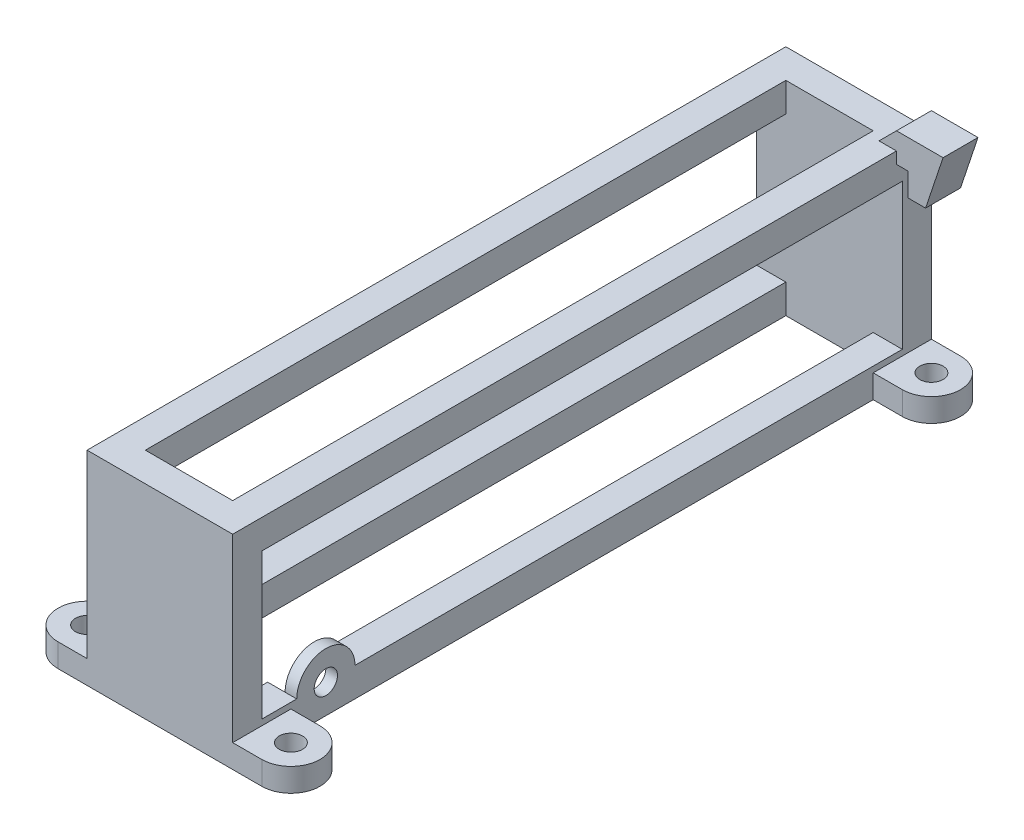
from build123d import *

# Parameters (mm, degrees)
SKETCH1_W           = 120
SKETCH1_H           = 35
SKETCH1_W_2         = 110
SKETCH1_H_2         = 25
BOSS_EXTRUDE1_DEPTH = 25
CUT_EXTRUDE1_REACH  = 129.475
SKETCH2_W           = 15
SKETCH2_H           = 110
SKETCH3_R           = 2
BOSS_EXTRUDE2_DEPTH = 4
SKETCH4_W           = 10
SKETCH4_H           = 5
CUT_EXTRUDE2_DEPTH  = 3
BOSS_EXTRUDE3_DEPTH = 2
SKETCH6_R           = 2
CUT_EXTRUDE3_DEPTH  = 2
BOSS_EXTRUDE4_DEPTH = 6


with BuildPart() as part:
    # Sketch1 → Boss-Extrude1 (new body)
    with BuildSketch(Plane(origin=(0, 0, 0), x_dir=(0, 0, -1), z_dir=(1, 0, 0))):
        with Locations((60, -17.5)):
            Rectangle(SKETCH1_W, SKETCH1_H)
        with Locations((60, -17.5)):
            Rectangle(SKETCH1_W_2, SKETCH1_H_2, mode=Mode.SUBTRACT)
    extrude(amount=BOSS_EXTRUDE1_DEPTH)

    # Cut-Extrude1: up to this face of the body (flat: up to its plane)
    cut_extrude1_end = Plane(part.part.faces().sort_by_distance((12.5, 0, -60))[0])
    # Sketch2 → Cut-Extrude1 (cut, up to the picked face)
    with BuildSketch(Plane(origin=(0, -35, 0), x_dir=(-1, 0, 0), z_dir=(0, -1, 0)), mode=Mode.PRIVATE) as cut_extrude1_sk1:
        with Locations((-12.5, 60)):
            Rectangle(SKETCH2_W, SKETCH2_H)
    cut_extrude1_tool1 = split(extrude(cut_extrude1_sk1.sketch, amount=-CUT_EXTRUDE1_REACH, mode=Mode.PRIVATE), bisect_by=cut_extrude1_end, keep=Keep.BOTH, mode=Mode.PRIVATE)
    add(cut_extrude1_tool1.solids().sort_by(Axis((12.5, -35, -60), (0, 1, 0)))[0], mode=Mode.SUBTRACT)

    # Sketch3 → Boss-Extrude2 (add)
    # profile 1 of 4: a face of its own
    with BuildSketch(Plane.XZ.offset(35)):
        with BuildLine():
            Line((0, -120), (-5, -120))
            ThreePointArc((-5, -120), (-10, -115), (-5, -110))
            Line((-5, -110), (0, -110))
            Line((0, -110), (0, -120))
        make_face()
        with Locations(Location((-5, -115, 0), (0, 0, 270))):
            Circle(SKETCH3_R, mode=Mode.SUBTRACT)
    # profile 2 of 4: a face of its own
    with BuildSketch(Plane.XZ.offset(35)):
        with BuildLine():
            Line((0, 0), (-5, 0))
            ThreePointArc((-5, 0), (-10, -5), (-5, -10))
            Line((-5, -10), (0, -10))
            Line((0, -10), (0, 0))
        make_face()
        with Locations(Location((-5, -5, 0), (0, 0, 270))):
            Circle(SKETCH3_R, mode=Mode.SUBTRACT)
    # profile 3 of 4: a face of its own
    with BuildSketch(Plane.XZ.offset(35)):
        with BuildLine():
            Line((25, -120), (30, -120))
            ThreePointArc((30, -120), (35, -115), (30, -110))
            Line((30, -110), (25, -110))
            Line((25, -110), (25, -120))
        make_face()
        with Locations(Location((30, -115, 0), (0, 0, 270))):
            Circle(SKETCH3_R, mode=Mode.SUBTRACT)
    # profile 4 of 4: a face of its own
    with BuildSketch(Plane.XZ.offset(35)):
        with BuildLine():
            Line((25, 0), (30, 0))
            ThreePointArc((30, 0), (35, -5), (30, -10))
            Line((30, -10), (25, -10))
            Line((25, -10), (25, 0))
        make_face()
        with Locations(Location((30, -5, 0), (0, 0, 270))):
            Circle(SKETCH3_R, mode=Mode.SUBTRACT)
    extrude(amount=-BOSS_EXTRUDE2_DEPTH)

    # Sketch4 → Cut-Extrude2 (cut)
    with BuildSketch(Plane.ZY.offset(-20)):
        with Locations((-16, -32.5)):
            Rectangle(SKETCH4_W, SKETCH4_H)
    extrude(amount=-CUT_EXTRUDE2_DEPTH, mode=Mode.SUBTRACT)

    # Sketch5 → Boss-Extrude3 (add)
    with BuildSketch(Plane.ZY.offset(-23)):
        with BuildLine():
            Line((-11, -30), (-21, -30))
            ThreePointArc((-21, -30), (-16, -25), (-11, -30))
        make_face()
    extrude(amount=-BOSS_EXTRUDE3_DEPTH)

    # Sketch6 → Cut-Extrude3 (cut)
    with BuildSketch(Plane.ZY.offset(-23)):
        with Locations((-16, -30)):
            Circle(SKETCH6_R)
    extrude(amount=-CUT_EXTRUDE3_DEPTH, mode=Mode.SUBTRACT)


with BuildPart() as body_2:
    # Sketch7 → Boss-Extrude4 (new body)
    with BuildSketch(Plane(origin=(0, 0, -120), x_dir=(-1, 0, 0), z_dir=(0, 0, -1))):
        Polygon((-27, -2), (-25, -2), (-25, 0), (-25, 3), (-33, 3), (-30, -6), (-27, -6), align=None)
        Polygon((-25, 3), (-25, 0), (-22, 0), align=None)
    extrude(amount=-BOSS_EXTRUDE4_DEPTH)


solid = Compound([part.part, body_2.part])
